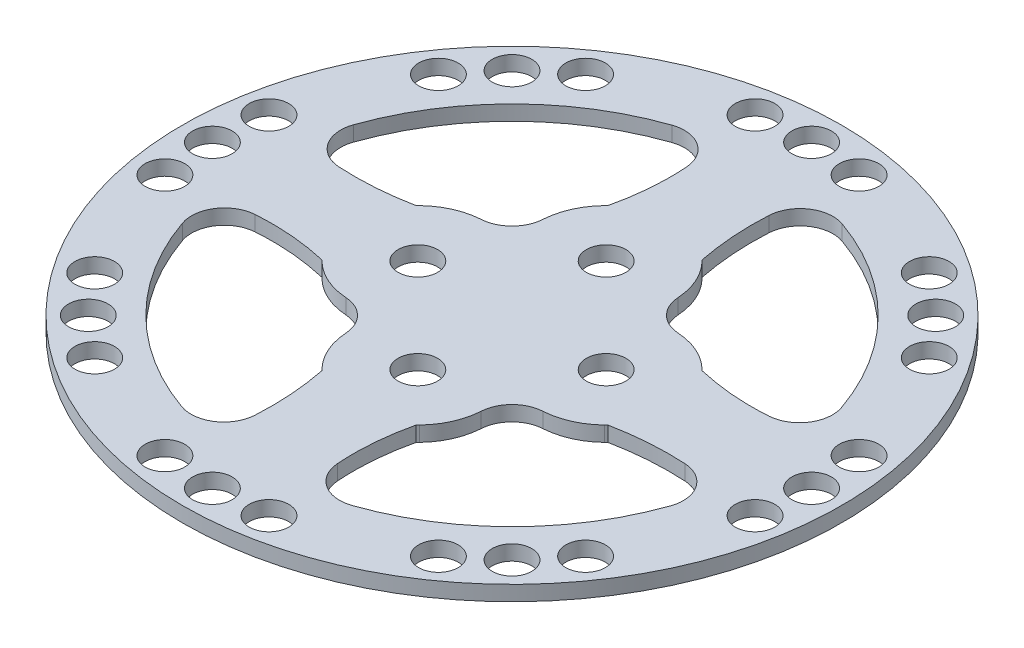
from build123d import *

# Parameters (mm, degrees)
SKETCH1_R           = 35
SKETCH1_R_2         = 2.1
BOSS_EXTRUDE1_DEPTH = 1.6
SKETCH8_R           = 2.1
CUT_EXTRUDE7_DEPTH  = 50.523327836
CUT_EXTRUDE8_DEPTH  = 1.6
FILLET2_R           = 3.5


with BuildPart() as part:
    # Sketch1 → Boss-Extrude1 (new body)
    with BuildSketch(Plane(origin=(0, 0, 0), x_dir=(1, 0, 0), z_dir=(0, 1, 0))):
        with Locations(Location((0, 0, 0), (0, 0, 270))):
            Circle(SKETCH1_R)
        with BuildLine():
            Line((27.041634566, 5), (15.180733539, 5))
            ThreePointArc((15.180733539, 5), (10.744877784, 7.161365588), (5.959166305, 5.959166305))
            ThreePointArc((5.959166305, 5.959166305), (7.161365588, 10.744877784), (5, 15.180733539))
            Line((5, 15.180733539), (5, 27.041634566))
            ThreePointArc((5, 27.041634566), (19.445436483, 19.445436483), (27.041634566, 5))
        make_face(mode=Mode.SUBTRACT)
        with BuildLine():
            Line((15.180733539, -5), (27.041634566, -5))
            ThreePointArc((27.041634566, -5), (19.445436483, -19.445436483), (5, -27.041634566))
            Line((5, -27.041634566), (5, -15.180733539))
            ThreePointArc((5, -15.180733539), (7.161365588, -10.744877784), (5.959166305, -5.959166305))
            ThreePointArc((5.959166305, -5.959166305), (10.744877784, -7.161365588), (15.180733539, -5))
        make_face(mode=Mode.SUBTRACT)
        with BuildLine():
            Line((-5, 27.041634566), (-5, 15.180733539))
            ThreePointArc((-5, 15.180733539), (-7.161365588, 10.744877784), (-5.959166305, 5.959166305))
            ThreePointArc((-5.959166305, 5.959166305), (-10.744877784, 7.161365588), (-15.180733539, 5))
            Line((-15.180733539, 5), (-27.041634566, 5))
            ThreePointArc((-27.041634566, 5), (-19.445436483, 19.445436483), (-5, 27.041634566))
        make_face(mode=Mode.SUBTRACT)
        with BuildLine():
            Line((-5, -15.180733539), (-5, -27.041634566))
            ThreePointArc((-5, -27.041634566), (-19.445436483, -19.445436483), (-27.041634566, -5))
            Line((-27.041634566, -5), (-15.180733539, -5))
            ThreePointArc((-15.180733539, -5), (-10.744877784, -7.161365588), (-5.959166305, -5.959166305))
            ThreePointArc((-5.959166305, -5.959166305), (-7.161365588, -10.744877784), (-5, -15.180733539))
        make_face(mode=Mode.SUBTRACT)
        with Locations(Location((-22.499999892, -22.499999892, 0), (0, 0, 270))):
            Circle(SKETCH1_R_2, mode=Mode.SUBTRACT)
        with Locations(Location((-18.251090357, -26.065258315, 0), (0, 0, 270))):
            Circle(SKETCH1_R_2, mode=Mode.SUBTRACT)
        with Locations(Location((-26.065258315, -18.251090357, 0), (0, 0, 270))):
            Circle(SKETCH1_R_2, mode=Mode.SUBTRACT)
        with Locations(Location((-5.525451152, -31.336390663, 0), (0, 0, 270))):
            Circle(SKETCH1_R_2, mode=Mode.SUBTRACT)
        with Locations(Location((-31.336390663, -5.525451152, 0), (0, 0, 270))):
            Circle(SKETCH1_R_2, mode=Mode.SUBTRACT)
        with Locations(Location((0, -31.819805, 0), (0, 0, 270))):
            Circle(SKETCH1_R_2, mode=Mode.SUBTRACT)
        with Locations(Location((5.525451152, -31.336390663, 0), (0, 0, 270))):
            Circle(SKETCH1_R_2, mode=Mode.SUBTRACT)
        with Locations(Location((18.251090357, -26.065258315, 0), (0, 0, 270))):
            Circle(SKETCH1_R_2, mode=Mode.SUBTRACT)
        with Locations(Location((22.499999892, -22.499999892, 0), (0, 0, 270))):
            Circle(SKETCH1_R_2, mode=Mode.SUBTRACT)
        with Locations(Location((26.065258315, -18.251090357, 0), (0, 0, 270))):
            Circle(SKETCH1_R_2, mode=Mode.SUBTRACT)
        with Locations(Location((31.336390663, -5.525451152, 0), (0, 0, 270))):
            Circle(SKETCH1_R_2, mode=Mode.SUBTRACT)
        with Locations(Location((-31.819805, 0, 0), (0, 0, 270))):
            Circle(SKETCH1_R_2, mode=Mode.SUBTRACT)
        with Locations(Location((-31.336390663, 5.525451152, 0), (0, 0, 270))):
            Circle(SKETCH1_R_2, mode=Mode.SUBTRACT)
        with Locations(Location((-26.065258315, 18.251090357, 0), (0, 0, 270))):
            Circle(SKETCH1_R_2, mode=Mode.SUBTRACT)
        with Locations(Location((-22.499999892, 22.499999892, 0), (0, 0, 270))):
            Circle(SKETCH1_R_2, mode=Mode.SUBTRACT)
        with Locations(Location((-18.251090357, 26.065258315, 0), (0, 0, 270))):
            Circle(SKETCH1_R_2, mode=Mode.SUBTRACT)
        with Locations(Location((-5.525451152, 31.336390663, 0), (0, 0, 270))):
            Circle(SKETCH1_R_2, mode=Mode.SUBTRACT)
        with Locations(Location((26.065258315, 18.251090357, 0), (0, 0, 270))):
            Circle(SKETCH1_R_2, mode=Mode.SUBTRACT)
        with Locations(Location((0, 31.819805, 0), (0, 0, 270))):
            Circle(SKETCH1_R_2, mode=Mode.SUBTRACT)
        with Locations(Location((5.525451152, 31.336390663, 0), (0, 0, 270))):
            Circle(SKETCH1_R_2, mode=Mode.SUBTRACT)
        with Locations(Location((18.251090357, 26.065258315, 0), (0, 0, 270))):
            Circle(SKETCH1_R_2, mode=Mode.SUBTRACT)
        with Locations(Location((22.499999892, 22.499999892, 0), (0, 0, 270))):
            Circle(SKETCH1_R_2, mode=Mode.SUBTRACT)
        with Locations(Location((31.819805, 0, 0), (0, 0, 270))):
            Circle(SKETCH1_R_2, mode=Mode.SUBTRACT)
        with Locations(Location((31.336390663, 5.525451152, 0), (0, 0, 270))):
            Circle(SKETCH1_R_2, mode=Mode.SUBTRACT)
    extrude(amount=BOSS_EXTRUDE1_DEPTH)

    # Sketch8 → Cut-Extrude7 (cut, through all)
    with BuildSketch(Plane(origin=(0, 1.6, 0), x_dir=(1, 0, 0), z_dir=(0, 1, 0))):
        with Locations(Location((-10, 0, 0), (0, 0, 270))):
            Circle(SKETCH8_R)
        with Locations(Location((0, 10, 0), (0, 0, 270))):
            Circle(SKETCH8_R)
        with Locations(Location((10, 0, 0), (0, 0, 270))):
            Circle(SKETCH8_R)
        with Locations(Location((0, -10, 0), (0, 0, 270))):
            Circle(SKETCH8_R)
    extrude(amount=-CUT_EXTRUDE7_DEPTH, mode=Mode.SUBTRACT)

    # Sketch10 → Cut-Extrude8 (cut)
    with BuildSketch(Plane(origin=(0, 1.6, 0), x_dir=(1, 0, 0), z_dir=(0, 1, 0))):
        with BuildLine():
            Line((-5, 27.041634566), (-27.041634566, 5))
            add(Edge.make_bspline(
                [(-27.041634566, 5), (-21.111184052, 3.821396017), (-15.180733539, 5)],
                knots=[0, 0, 0, 1, 1, 1], degree=2))
            Line((-15.180733539, 5), (-5, 15.180733539))
            add(Edge.make_bspline(
                [(-5, 15.180733539), (-3.616076382, 21.111184052), (-5, 27.041634566)],
                knots=[0, 0, 0, 1, 1, 1], degree=2))
        make_face()
        with BuildLine():
            Line((27.041634566, 5), (5, 27.041634566))
            add(Edge.make_bspline(
                [(5, 27.041634566), (3.821396017, 21.111184052), (5, 15.180733539)],
                knots=[0, 0, 0, 1, 1, 1], degree=2))
            Line((5, 15.180733539), (15.180733539, 5))
            add(Edge.make_bspline(
                [(15.180733539, 5), (21.111184052, 3.616076382), (27.041634566, 5)],
                knots=[0, 0, 0, 1, 1, 1], degree=2))
        make_face()
        with BuildLine():
            Line((5, -27.041634566), (27.041634566, -5))
            add(Edge.make_bspline(
                [(27.041634566, -5), (21.111184052, -3.821396017), (15.180733539, -5)],
                knots=[0, 0, 0, 1, 1, 1], degree=2))
            Line((15.180733539, -5), (5, -15.180733539))
            add(Edge.make_bspline(
                [(5, -15.180733539), (3.616076382, -21.111184052), (5, -27.041634566)],
                knots=[0, 0, 0, 1, 1, 1], degree=2))
        make_face()
        with BuildLine():
            Line((-27.041634566, -5), (-5, -27.041634566))
            add(Edge.make_bspline(
                [(-5, -27.041634566), (-3.821396017, -21.111184052), (-5, -15.180733539)],
                knots=[0, 0, 0, 1, 1, 1], degree=2))
            Line((-5, -15.180733539), (-15.180733539, -5))
            add(Edge.make_bspline(
                [(-15.180733539, -5), (-21.111184052, -3.616076382), (-27.041634566, -5)],
                knots=[0, 0, 0, 1, 1, 1], degree=2))
        make_face()
    extrude(amount=-CUT_EXTRUDE8_DEPTH, mode=Mode.SUBTRACT)

    # Fillet2
    fillet2_edges = [part.edges().sort_by_distance(p)[0] for p in [
        (5.959166305, 0.8, -5.959166305),
        (5.959166305, 0.8, 5.959166305),
        (-5.959166305, 0.8, 5.959166305),
        (-5.959166305, 0.8, -5.959166305),
        (-5, 0.8, -27.041634566),
        (5, 0.8, -27.041634566),
        (27.041634566, 0.8, -5),
        (27.041634566, 0.8, 5),
        (5, 0.8, 27.041634566),
        (-5, 0.8, 27.041634566),
        (-27.041634566, 0.8, 5),
        (-27.041634566, 0.8, -5),
    ]]
    fillet(fillet2_edges, radius=FILLET2_R)


solid = part.part
